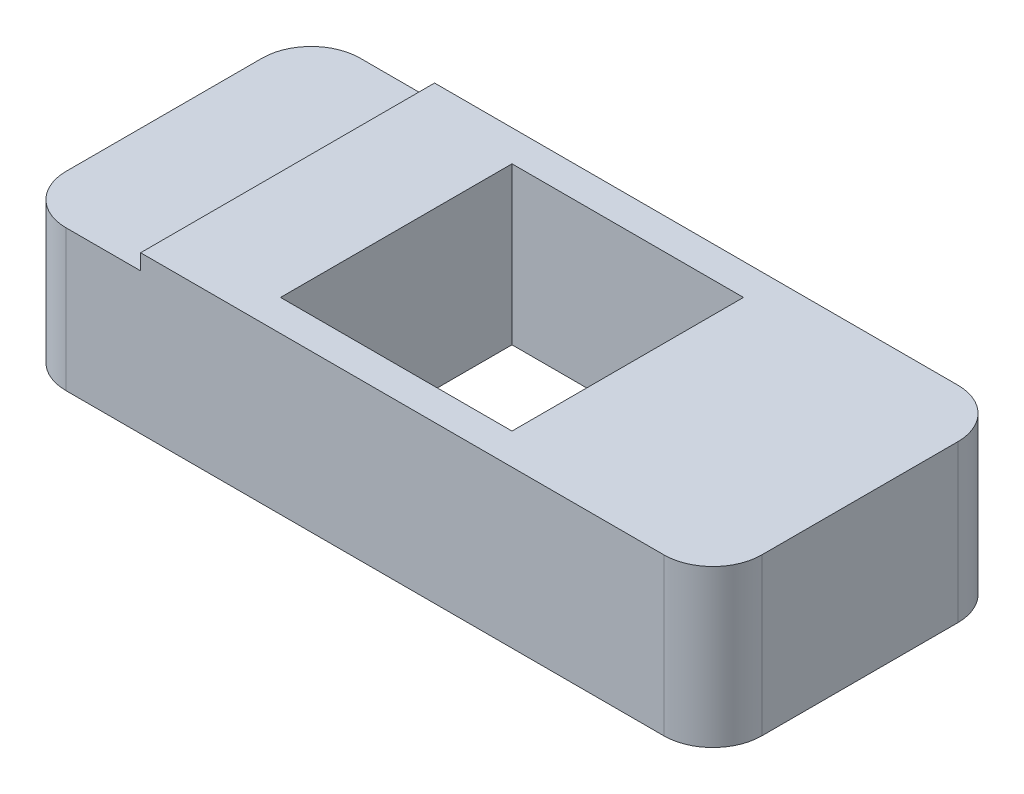
from build123d import *

# Parameters (mm, degrees)
SKETCH1_W               = 45.085
SKETCH1_H               = 19.05
BOSS_EXTRUDE1_DEPTH     = 10.16
SKETCH2_W               = 15
SKETCH2_H               = 15
CUT_EXTRUDE1_DEPTH      = 27.497462732
FILLET1_R               = 3.175
CUT_EXTRUDE2_DEPTH      = 27.497462732
CUT_EXTRUDE2_DEPTH_BACK = 1.016
CUT_EXTRUDE3_DEPTH      = 8.636


with BuildPart() as part:
    # Sketch1 → Boss-Extrude1 (new body)
    with BuildSketch(Plane(origin=(0, 0, 0), x_dir=(1, 0, 0), z_dir=(0, 1, 0))):
        Rectangle(SKETCH1_W, SKETCH1_H)
    extrude(amount=-BOSS_EXTRUDE1_DEPTH)

    # Sketch2 → Cut-Extrude1 (cut, through all)
    with BuildSketch(Plane(origin=(0, 0, 0), x_dir=(1, 0, 0), z_dir=(0, 1, 0))):
        Rectangle(SKETCH2_W, SKETCH2_H)
    extrude(amount=-CUT_EXTRUDE1_DEPTH, mode=Mode.SUBTRACT)

    # Fillet1
    fillet1_edges = [part.edges().sort_by_distance(p)[0] for p in [
        (22.5425, -5.08, 9.525),
        (-22.5425, -5.08, 9.525),
        (-22.5425, -5.08, -9.525),
        (22.5425, -5.08, -9.525),
    ]]
    fillet(fillet1_edges, radius=FILLET1_R)

    # Sketch3 → Cut-Extrude2 (cut, two sides: drawn at the far end of the back side and taken through both)
    with BuildSketch(Plane(origin=(0, 0, 0), x_dir=(1, 0, 0), z_dir=(0, 1, 0)).offset(-CUT_EXTRUDE2_DEPTH_BACK)):
        Polygon((-14.5425, -102.908445), (-14.5425, -9.525), (-14.5425, 9.525), (-14.5425, 102.908445), (-201.309389999, 102.908445), (-201.309389999, -102.908445), align=None)
    extrude(amount=CUT_EXTRUDE2_DEPTH + CUT_EXTRUDE2_DEPTH_BACK, mode=Mode.SUBTRACT)

    # Sketch5 → Cut-Extrude3 (cut)
    with BuildSketch(Plane.XZ.offset(10.16)):
        Polygon((-21.216, -3.666174209), (-14.866, -7.332348419), (-8.516, -3.666174209), (-8.516, 3.666174209), (-14.866, 7.332348419), (-21.216, 3.666174209), align=None)
        Polygon((8.516, -3.666174209), (14.866, -7.332348419), (21.216, -3.666174209), (21.216, 3.666174209), (14.866, 7.332348419), (8.516, 3.666174209), align=None)
    extrude(amount=-CUT_EXTRUDE3_DEPTH, mode=Mode.SUBTRACT)


solid = part.part
